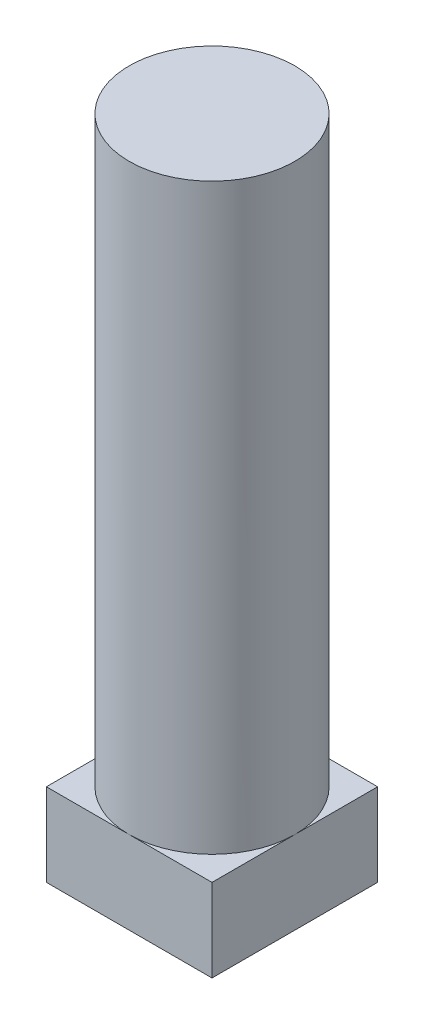
from build123d import *

# Parameters (mm, degrees)
SKETCH1_W           = 5
SKETCH1_H           = 5
BOSS_EXTRUDE1_DEPTH = 2.5
SKETCH2_R           = 2.5
BOSS_EXTRUDE2_DEPTH = 17.6


with BuildPart() as part:
    # Sketch1 → Boss-Extrude1 (new body)
    with BuildSketch(Plane(origin=(0, 0, 0), x_dir=(1, 0, 0), z_dir=(0, 1, 0))):
        Rectangle(SKETCH1_W, SKETCH1_H)
    extrude(amount=BOSS_EXTRUDE1_DEPTH)

    # Sketch2 → Boss-Extrude2 (add)
    with BuildSketch(Plane(origin=(0, 2.5, 0), x_dir=(1, 0, 0), z_dir=(0, 1, 0))):
        with Locations(Location((0, 0, 0), (0, 0, 270))):
            Circle(SKETCH2_R)
    extrude(amount=BOSS_EXTRUDE2_DEPTH)


solid = part.part
